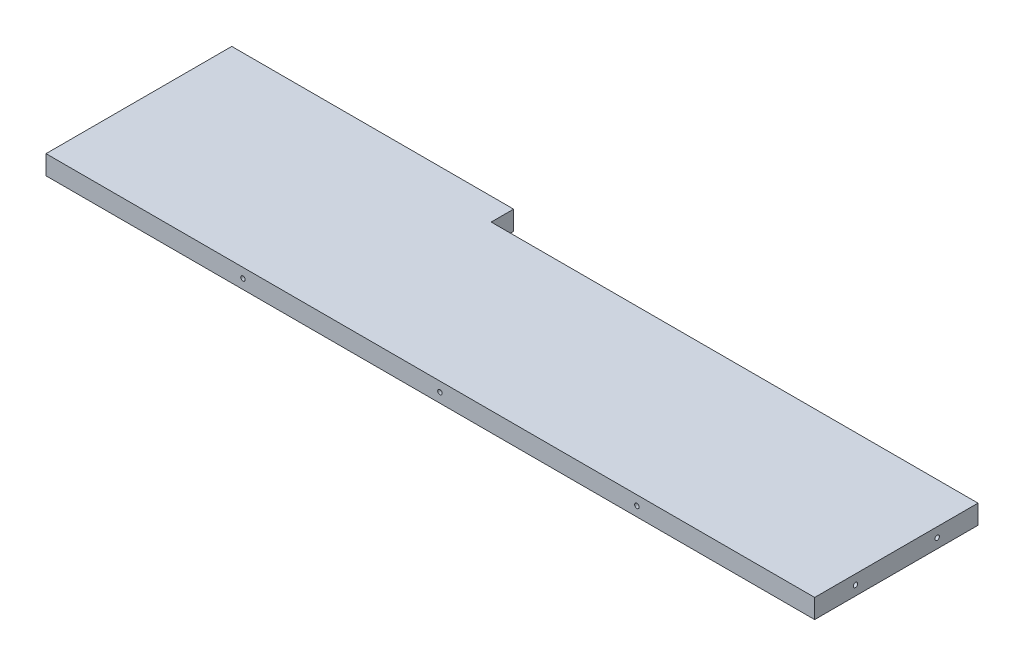
from build123d import *

# Parameters (mm, degrees)
SKETCH_1_W          = 120
SKETCH_1_H          = 29
EXTRUDE_1_DEPTH     = 3
SKETCH_2_W          = 76
SKETCH_2_H          = 3.5
CUT_EXTRUDE_1_DEPTH = 62.800080906
SKETCH_3_R          = 0.35
CUT_EXTRUDE_2_DEPTH = 3
SKETCH_5_R          = 0.35
CUT_EXTRUDE_3_DEPTH = 3


with BuildPart() as part:
    # 草图1 → 凸台-拉伸1 (new body)
    with BuildSketch(Plane(origin=(0, 0, 0), x_dir=(1, 0, 0), z_dir=(0, 1, 0))):
        Rectangle(SKETCH_1_W, SKETCH_1_H)
    extrude(amount=EXTRUDE_1_DEPTH)

    # 草图2 → 切除-拉伸1 (cut, through all)
    with BuildSketch(Plane.XZ):
        with Locations((22, -12.75)):
            Rectangle(SKETCH_2_W, SKETCH_2_H)
    extrude(amount=-CUT_EXTRUDE_1_DEPTH, mode=Mode.SUBTRACT)

    # 草图3 → 切除-拉伸2 (cut)
    with BuildSketch(Plane(origin=(60, 0, 0), x_dir=(0, 0, -1), z_dir=(1, 0, 0))):
        with Locations((-8.125, 1.5)):
            Circle(SKETCH_3_R)
        with Locations((4.625, 1.5)):
            Circle(SKETCH_3_R)
    extrude(amount=-CUT_EXTRUDE_2_DEPTH, mode=Mode.SUBTRACT)

    # 草图5 → 切除-拉伸3 (cut)
    with BuildSketch(Plane.XY.offset(14.5)):
        with Locations((-29.25, 1.5)):
            Circle(SKETCH_5_R)
        with Locations((1.5, 1.5)):
            Circle(SKETCH_5_R)
        with Locations((32.25, 1.5)):
            Circle(SKETCH_5_R)
    extrude(amount=-CUT_EXTRUDE_3_DEPTH, mode=Mode.SUBTRACT)


solid = part.part
